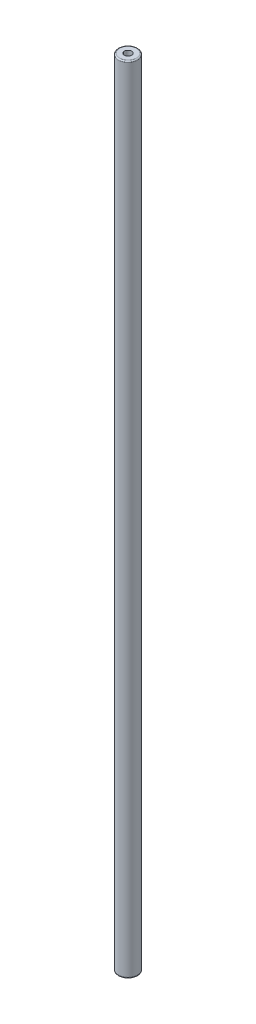
from build123d import *

# Parameters (mm, degrees)
EXTRUDE_1_DEPTH      = 164.95
EXTRUDE_1_DEPTH_BACK = 164.95
SKETCH_1_R           = 4
SKETCH_2_R           = 1.5
EXTRUDE_2_DEPTH      = 5
FILLET_1_R           = 0.5


with BuildPart() as part:
    # Эскиз1 → Выдавливание1 (new, two sides: drawn at the far end of the back side and taken through both)
    with BuildSketch(Plane(origin=(0, 0, 0), x_dir=(-1, 0, 0), z_dir=(0, 1, 0)).offset(-EXTRUDE_1_DEPTH_BACK)):
        with Locations(Location((0, 0, 0), (0, 0, 90))):
            Circle(SKETCH_1_R)
    extrude(amount=EXTRUDE_1_DEPTH + EXTRUDE_1_DEPTH_BACK)

    # Эскиз2 → Выдавливание2 (cut)
    with BuildSketch(Plane(origin=(0, 164.95, 0), x_dir=(-1, 0, 0), z_dir=(0, 1, 0))):
        with Locations(Location((0, 0, 0), (0, 0, 90))):
            Circle(SKETCH_2_R)
    extrude_2 = extrude(amount=-EXTRUDE_2_DEPTH, mode=Mode.SUBTRACT)

    # Зеркальное отражение1: Выдавливание2 across plane
    add(extrude_2.mirror(Plane.ZX), mode=Mode.SUBTRACT)

    # Сопряжение1
    fillet_1_edges = [part.edges().sort_by_distance(p)[0] for p in [
        (0, -164.95, -4),
        (0, 164.95, -4),
    ]]
    fillet(fillet_1_edges, radius=FILLET_1_R)


solid = part.part
